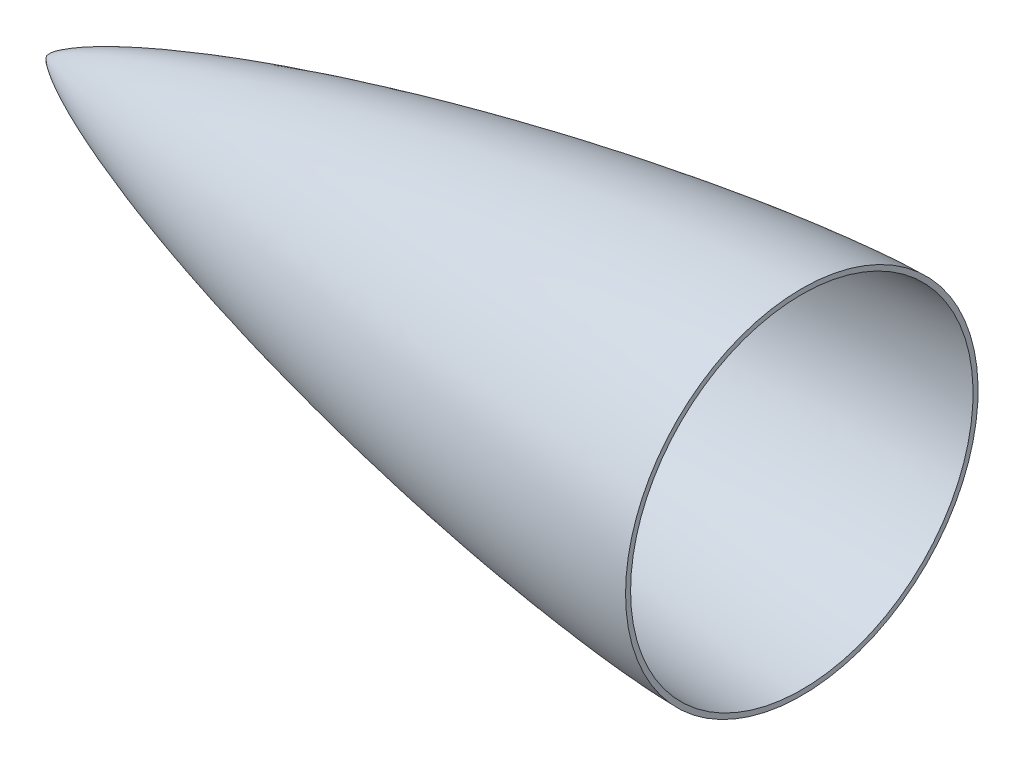
from build123d import *


with BuildPart() as part:
    # Esboço6 → Revolução6 (revolve)
    with BuildSketch(Plane.XY):
        with BuildLine():
            Line((0, 0), (1, 0))
            add(Edge.make_bspline(
                [(1, 0), (1.317387187, 0.364121806), (1.904332573, 1.037493708), (2.98583019, 1.738441224), (3.987412543, 2.363831692), (4.992870183, 2.927517138), (5.994384573, 3.457389697), (6.995732115, 3.959393806), (7.996519081, 4.439779623), (8.997109587, 4.902069914), (9.997538783, 5.348998537), (10.997869768, 5.782568712), (11.998129744, 6.204349403), (12.998339335, 6.61558836), (13.998510481, 7.017305023), (14.998652882, 7.41034043), (15.99877341, 7.795401935), (16.998875611, 8.173095873), (17.998963433, 8.543940078), (18.999040288, 8.908383115), (20.331298003, 9.38588476), (21.996871021, 9.96876551), (23.997225797, 10.648553271), (25.997513657, 11.309944886), (27.997750429, 11.954493301), (29.997949274, 12.583486258), (31.99811672, 13.198019507), (34.330614487, 13.898882546), (36.99648899, 14.678748333), (39.996820101, 15.53010474), (42.997093205, 16.356962937), (45.997323681, 17.160863637), (48.997518705, 17.943114869), (51.997686083, 18.704813694), (55.330380838, 19.529152706), (58.663900761, 20.329320775), (62.330744282, 21.18393372), (65.66421555, 21.93833123), (69.331015221, 22.744249903), (72.997141119, 23.526655849), (76.997281115, 24.351919174), (80.997401802, 25.149281193), (85.330174603, 25.983131687), (89.996274836, 26.84530821), (94.330980994, 27.609337962), (97.998736944, 28.230645111), (101.331637196, 28.777940863), (104.332069869, 29.252276533), (107.99827131, 29.812201171), (111.331187697, 30.300137472), (114.998831521, 30.809413604), (117.665849222, 31.16418898), (119.999486283, 31.46284654), (122.332522106, 31.751759534), (124.665856209, 32.028254827), (126.9994884, 32.291653528), (128.999487992, 32.508029453), (130.999486827, 32.714619608), (132.999485034, 32.910924999), (134.999482686, 33.096351776), (136.999479758, 33.270181997), (138.666361281, 33.404657796), (139.999868432, 33.505423413), (140.999867793, 33.577405015), (141.999867173, 33.645598934), (142.999866303, 33.709768489), (143.999865593, 33.769613382), (144.99986449, 33.824789584), (145.999863865, 33.874783557), (146.99986122, 33.919137565), (147.999864653, 33.956326487), (148.999840447, 33.987153947), (149.666645898, 33.995718399), (150, 34)],
                knots=[0, 0, 0, 0, 0.009357391, 0.017304661, 0.024935004, 0.03239434, 0.039741596, 0.047007743, 0.054211499, 0.061365219, 0.068477578, 0.075554952, 0.082602189, 0.08962308, 0.096620666, 0.103597417, 0.110555381, 0.117496284, 0.124421587, 0.13133254, 0.138230234, 0.151989521, 0.16570577, 0.179383982, 0.1930282, 0.206641739, 0.220227369, 0.233787425, 0.254083848, 0.274332773, 0.294538778, 0.31470564, 0.334836531, 0.354934131, 0.375000739, 0.401711387, 0.421712935, 0.448342485, 0.468286874, 0.494844413, 0.521363997, 0.547847538, 0.574296686, 0.607311903, 0.640277945, 0.660034792, 0.679775006, 0.706069961, 0.719206765, 0.752018204, 0.771684389, 0.791335257, 0.804427384, 0.817512785, 0.837128316, 0.850196973, 0.863258945, 0.87631423, 0.889362816, 0.902404684, 0.915439808, 0.928468151, 0.934979765, 0.941489666, 0.947997847, 0.954504298, 0.96100901, 0.967511973, 0.974013175, 0.980512603, 0.987010241, 0.993506068, 1, 1, 1, 1], degree=3))
            Line((150, 34), (150, 35))
            add(Edge.make_bspline(
                [(0, 0), (0.316891895, 0.372641581), (0.901721127, 1.06035778), (1.985242834, 1.780391345), (2.986990575, 2.420936587), (3.992595, 2.998478591), (4.994172375, 3.541272769), (5.995564725, 4.055534305), (6.996381818, 4.547642648), (7.996993526, 5.021221046), (8.997439026, 5.479066205), (9.997783119, 5.923231703), (10.998052821, 6.355328173), (11.998270476, 6.776631801), (12.998448471, 7.18818641), (13.998596677, 7.590854272), (14.998721921, 7.985361029), (15.998827826, 8.372327502), (16.998919932, 8.752280613), (17.998999295, 9.125686066), (18.999069145, 9.492945914), (20.331349074, 9.974498435), (21.996932268, 10.562896159), (23.997264021, 11.249843054), (25.997535063, 11.918802839), (27.997761332, 12.571219041), (29.997950769, 13.208312868), (31.998112514, 13.831110447), (34.330599058, 14.541753737), (36.996458835, 15.332931025), (39.996781513, 16.19712296), (43.329329099, 17.129832593), (46.995280689, 18.123137909), (50.663330611, 19.08226075), (54.330251693, 20.012530805), (57.331134336, 20.751438797), (60.664599079, 21.551902605), (63.996646722, 22.332164001), (68.329345335, 23.313563152), (71.664730666, 24.041221585), (74.665885919, 24.67974327), (77.996365254, 25.376398445), (82.994089984, 26.382108244), (88.661941222, 27.463599715), (93.663622678, 28.370393782), (97.997675675, 29.122215812), (101.664913183, 29.732580677), (104.998742545, 30.266585708), (108.331635507, 30.782261266), (111.997826538, 31.325700973), (115.665008316, 31.841138067), (118.998798295, 32.286341894), (121.998802949, 32.668241534), (124.998805252, 33.030557793), (127.665825418, 33.334325943), (129.999467702, 33.585903815), (131.999466368, 33.791292826), (133.999464051, 33.98591458), (135.999461315, 34.169099555), (137.666350743, 34.311568494), (139.333015348, 34.445723944), (140.666346824, 34.546108298), (141.999861926, 34.638797214), (142.999861204, 34.704197214), (143.999860357, 34.765193296), (144.999859271, 34.821428478), (145.999858561, 34.87238356), (146.999855834, 34.917588386), (147.999859438, 34.955489225), (148.999834262, 34.986908502), (149.666645092, 34.995636608), (150, 35)],
                knots=[0, 0, 0, 0, 0.009399286, 0.017346537, 0.024966444, 0.032409534, 0.039736663, 0.046979834, 0.054158398, 0.061285139, 0.068369029, 0.075416667, 0.082433074, 0.089422176, 0.096387118, 0.10333046, 0.110254327, 0.117160504, 0.124050501, 0.130925622, 0.13778699, 0.144635591, 0.158297849, 0.171918207, 0.185501317, 0.199050965, 0.212570294, 0.226061933, 0.239528121, 0.259683805, 0.279791912, 0.29985689, 0.3265494, 0.353178927, 0.373113278, 0.399645935, 0.412893522, 0.439353478, 0.465769082, 0.49873031, 0.505315152, 0.525055444, 0.564474523, 0.603815965, 0.636544347, 0.662691794, 0.68880886, 0.708377175, 0.727929088, 0.753973189, 0.779988993, 0.799482488, 0.818960369, 0.838422711, 0.857869552, 0.870825505, 0.883774564, 0.896716714, 0.90965193, 0.922580179, 0.929041678, 0.941959395, 0.948415597, 0.954870017, 0.961322645, 0.967773472, 0.974222483, 0.980669667, 0.987115006, 0.993558479, 1, 1, 1, 1], degree=3))
        make_face()
    revolve(axis=Axis((0, 0, 0), (1, 0, 0)))


solid = part.part
